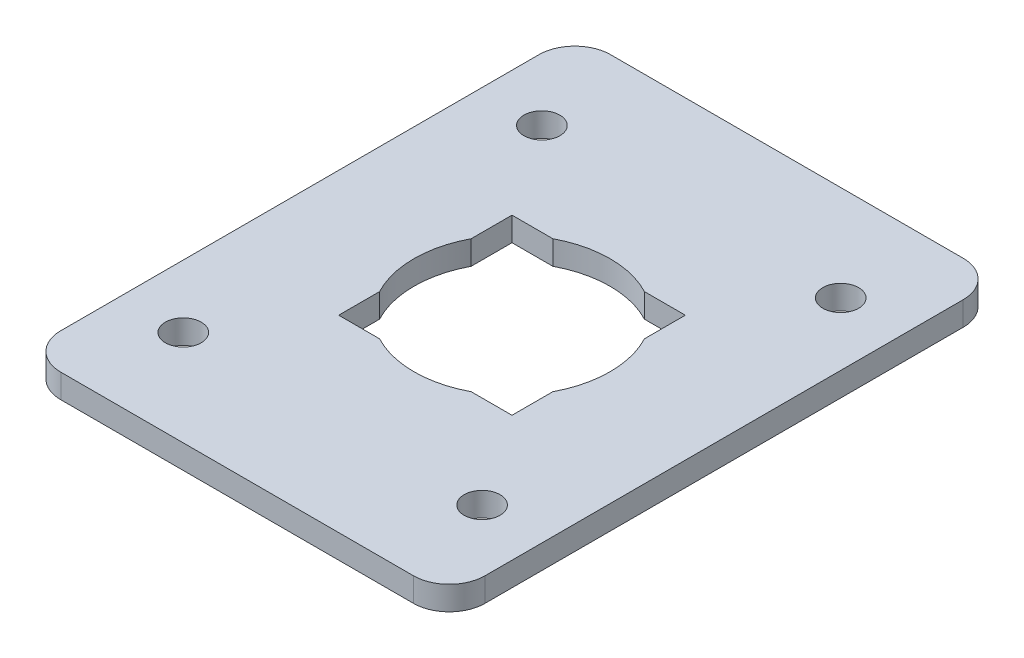
from build123d import *

# Parameters (mm, degrees)
SKETCH_1_W          = 35.5
SKETCH_1_H          = 46
EXTRUDE_1_DEPTH     = 2
FILLET_2_R          = 3
SKETCH_3_R          = 1.5
CUT_EXTRUDE_1_DEPTH = 10


with BuildPart() as part:
    # 草图1 → 凸台-拉伸1 (new body)
    with BuildSketch(Plane(origin=(0, 0, 0), x_dir=(1, 0, 0), z_dir=(0, 1, 0))):
        with Locations((0.862287952, 7.25)):
            Rectangle(SKETCH_1_W, SKETCH_1_H)
        with BuildLine():
            Line((-6.387712048, 3.418877449), (-6.387712048, 0))
            Line((-6.387712048, 0), (-2.968834599, 0))
            ThreePointArc((-2.968834599, 0), (0.862287952, -0.95), (4.693410503, 0))
            Line((4.693410503, 0), (8.112287952, 0))
            Line((8.112287952, 0), (8.112287952, 3.418877449))
            ThreePointArc((8.112287952, 3.418877449), (9.062287952, 7.25), (8.112287952, 11.081122551))
            Line((8.112287952, 11.081122551), (8.112287952, 14.5))
            Line((8.112287952, 14.5), (4.693410503, 14.5))
            ThreePointArc((4.693410503, 14.5), (0.862287952, 15.45), (-2.968834599, 14.5))
            Line((-2.968834599, 14.5), (-6.387712048, 14.5))
            Line((-6.387712048, 14.5), (-6.387712048, 11.081122551))
            ThreePointArc((-6.387712048, 11.081122551), (-7.337712048, 7.25), (-6.387712048, 3.418877449))
        make_face(mode=Mode.SUBTRACT)
    extrude(amount=EXTRUDE_1_DEPTH)

    # 圆角2
    fillet_2_edges = [part.edges().sort_by_distance(p)[0] for p in [
        (-16.887712048, 1, -30.25),
        (18.612287952, 1, -30.25),
        (18.612287952, 1, 15.75),
        (-16.887712048, 1, 15.75),
    ]]
    fillet(fillet_2_edges, radius=FILLET_2_R)

    # 草图3 → 切除-拉伸1 (cut)
    with BuildSketch(Plane.XZ):
        with Locations(Location((-11.637712048, 7.75, 0), (0, 0, 270))):
            Circle(SKETCH_3_R)
        with Locations(Location((-11.637712048, -22.25, 0), (0, 0, 270))):
            Circle(SKETCH_3_R)
        with Locations(Location((13.362287952, -22.25, 0), (0, 0, 270))):
            Circle(SKETCH_3_R)
        with Locations(Location((13.362287952, 7.75, 0), (0, 0, 270))):
            Circle(SKETCH_3_R)
    extrude(amount=-CUT_EXTRUDE_1_DEPTH, mode=Mode.SUBTRACT)


solid = part.part
